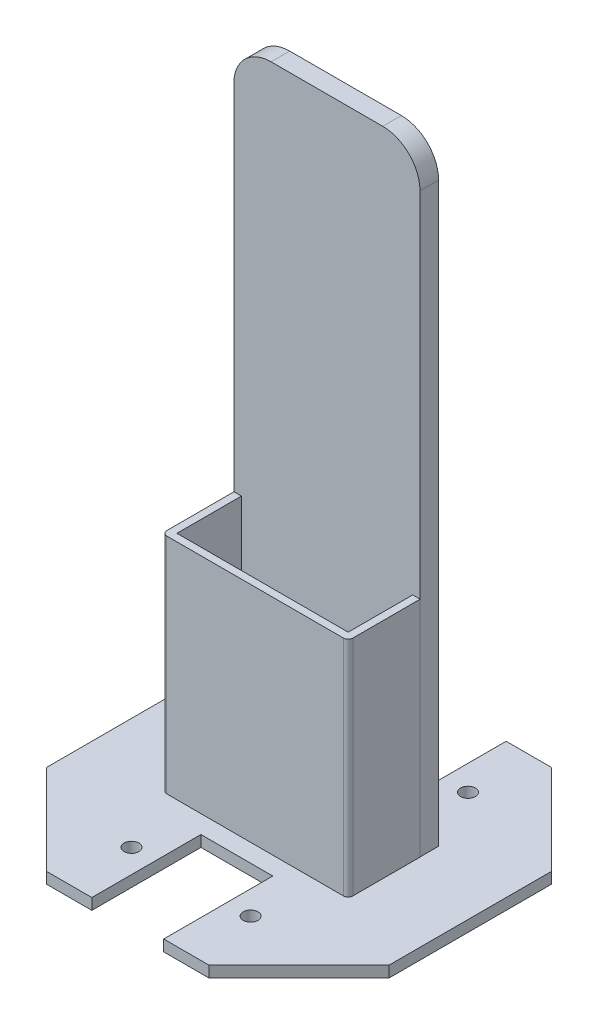
from build123d import *

# Parameters (mm, degrees)
SALIENTE_EXTRUIR1_DEPTH  = 3
CROQUIS2_W               = 50
CROQUIS2_H               = 25
SALIENTE_EXTRUIR2_DEPTH  = 165
CROQUIS5_W               = 20
CROQUIS5_H               = 165
CROQUIS5_W_2             = 1.746423124
CROQUIS5_H_2             = 0.642620727
CORTAR_EXTRUIR2_DEPTH    = 76
REDONDEO1_R              = 10
CROQUIS8_W               = 50
CROQUIS8_H               = 19.339026843
SALIENTE_EXTRUIR10_DEPTH = 60
CROQUIS12_W              = 46
CROQUIS12_H              = 15.339026843
CORTAR_EXTRUIR6_DEPTH    = 60
REDONDEO5_R              = 1.25
CROQUIS15_W              = 46
CROQUIS15_H              = 60
CORTAR_EXTRUIR7_DEPTH    = 2
CROQUIS16_R              = 2
CROQUIS16_W              = 19.3
CROQUIS16_H              = 29.3
CORTAR_EXTRUIR8_DEPTH    = 12


with BuildPart() as part:
    # Croquis1 → Saliente-Extruir1 (new body)
    with BuildSketch(Plane(origin=(0, 0, 0), x_dir=(1, 0, 0), z_dir=(0, 1, 0))):
        Polygon((-46, 21.805695142), (-46, -21.805695142), (-21.805695142, -46), (21.805695142, -46), (46, -21.805695142), (46, 21.805695142), (21.805695142, 46), (-21.805695142, 46), align=None)
    extrude(amount=SALIENTE_EXTRUIR1_DEPTH)

    # Croquis2 → Saliente-Extruir2 (add)
    with BuildSketch(Plane(origin=(0, 3, 0), x_dir=(1, 0, 0), z_dir=(0, 1, 0))):
        Rectangle(CROQUIS2_W, CROQUIS2_H)
    extrude(amount=SALIENTE_EXTRUIR2_DEPTH)

    # Croquis5 → Cortar-Extruir2 (cut)
    with BuildSketch(Plane.ZY.offset(25)):
        with Locations((2.5, 85.5)):
            Rectangle(CROQUIS5_W, CROQUIS5_H)
        with Locations((-13.373211562, 137.85800573)):
            Rectangle(CROQUIS5_W_2, CROQUIS5_H_2)
    extrude(amount=-CORTAR_EXTRUIR2_DEPTH, mode=Mode.SUBTRACT)

    # Redondeo1
    redondeo1_edges = [part.edges().sort_by_distance(p)[0] for p in [
        (-25, 168, -10),
        (25, 168, -10),
    ]]
    fillet(redondeo1_edges, radius=REDONDEO1_R)

    # Croquis8 → Saliente-Extruir10 (add)
    with BuildSketch(Plane(origin=(0, 3, -4.577154817), x_dir=(1, 0, 0), z_dir=(0, 1, 0))):
        with Locations((0.044911917, -6.746668238)):
            Rectangle(CROQUIS8_W, CROQUIS8_H)
    extrude(amount=SALIENTE_EXTRUIR10_DEPTH)

    # Croquis12 → Cortar-Extruir6 (cut)
    with BuildSketch(Plane(origin=(0, 63, 0), x_dir=(1, 0, 0), z_dir=(0, 1, 0))):
        with Locations((0.044911917, -2.169513422)):
            Rectangle(CROQUIS12_W, CROQUIS12_H)
    extrude(amount=-CORTAR_EXTRUIR6_DEPTH, mode=Mode.SUBTRACT)

    # Redondeo5
    redondeo5_edges = [part.edges().sort_by_distance(p)[0] for p in [
        (-24.955088083, 33, 11.839026843),
        (25.044911917, 33, 11.839026843),
    ]]
    fillet(redondeo5_edges, radius=REDONDEO5_R)

    # Croquis15 → Cortar-Extruir7 (cut)
    with BuildSketch(Plane.XY.offset(-5.5)):
        with Locations((0.044911917, 33)):
            Rectangle(CROQUIS15_W, CROQUIS15_H)
    extrude(amount=-CORTAR_EXTRUIR7_DEPTH, mode=Mode.SUBTRACT)

    # Croquis16 → Cortar-Extruir8 (cut)
    with BuildSketch(Plane(origin=(0, 3, 0), x_dir=(1, 0, 0), z_dir=(0, 1, 0))):
        with Locations(Location((-17, 29, 0), (0, 0, 270))):
            Circle(CROQUIS16_R)
        with Locations(Location((16.4, 29, 0), (0, 0, 270))):
            Circle(CROQUIS16_R)
        with Locations(Location((-16, -29, 0), (0, 0, 270))):
            Circle(CROQUIS16_R)
        with Locations(Location((16, -29, 0), (0, 0, 270))):
            Circle(CROQUIS16_R)
        with Locations((0, 31.35)):
            Rectangle(CROQUIS16_W, CROQUIS16_H)
        with Locations((0, -31.35)):
            Rectangle(CROQUIS16_W, CROQUIS16_H)
    extrude(amount=-CORTAR_EXTRUIR8_DEPTH, mode=Mode.SUBTRACT)


solid = part.part
